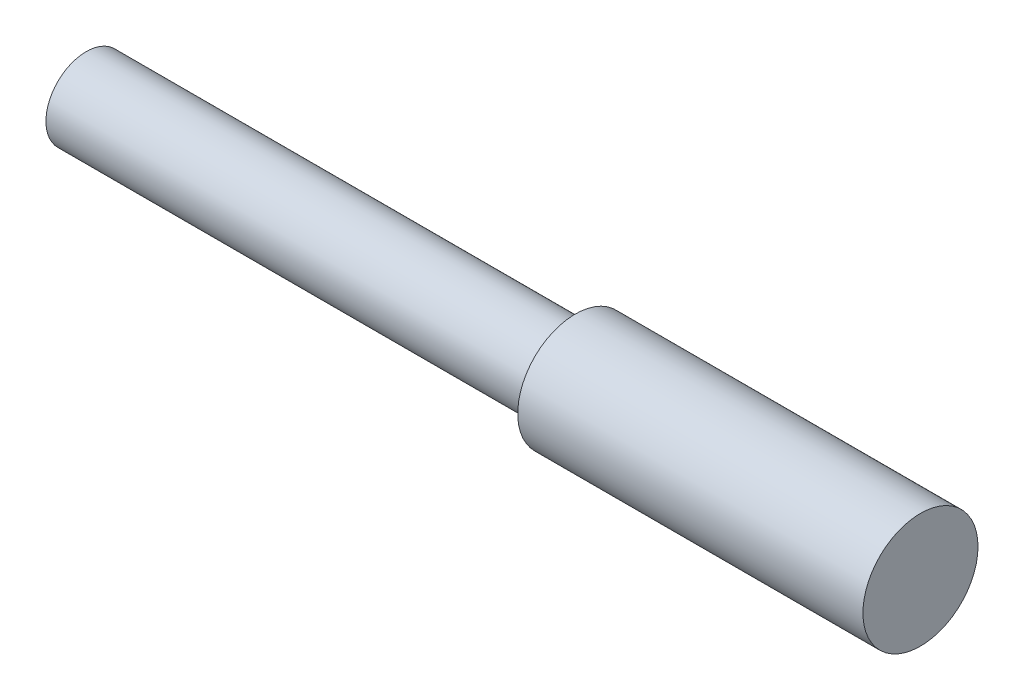
from build123d import *

# Parameters (mm, degrees)
SKETCH1_R           = 10
BOSS_EXTRUDE1_DEPTH = 145
SKETCH2_R           = 10
SKETCH2_R_2         = 7
CUT_EXTRUDE1_DEPTH  = 97


with BuildPart() as part:
    # Sketch1 → Boss-Extrude1 (new body)
    with BuildSketch(Plane(origin=(0, 0, 0), x_dir=(0, 0, -1), z_dir=(1, 0, 0))):
        Circle(SKETCH1_R)
    extrude(amount=-BOSS_EXTRUDE1_DEPTH)

    # Sketch2 → Cut-Extrude1 (cut)
    with BuildSketch(Plane(origin=(-60, 0, 0), x_dir=(0, 0, -1), z_dir=(1, 0, 0))):
        Circle(SKETCH2_R)
        Circle(SKETCH2_R_2, mode=Mode.SUBTRACT)
    extrude(amount=-CUT_EXTRUDE1_DEPTH, mode=Mode.SUBTRACT)


solid = part.part
